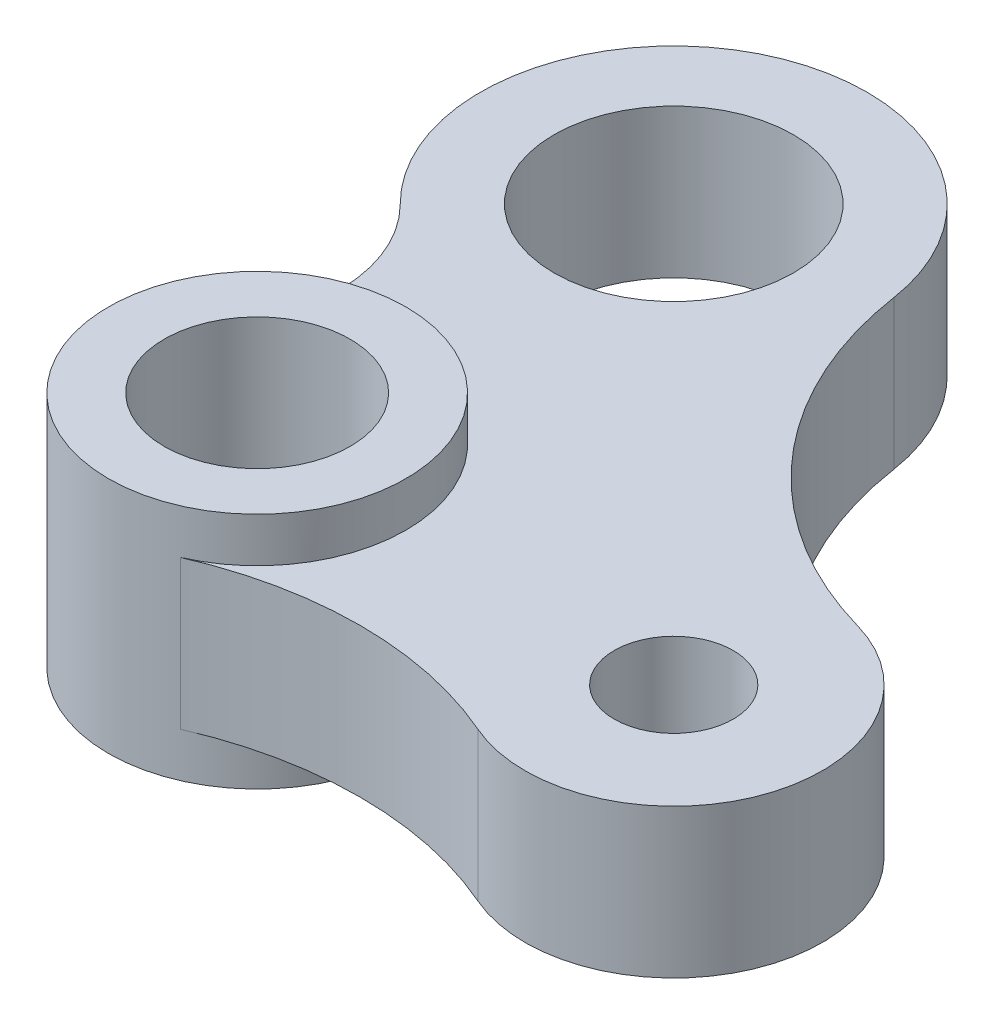
from build123d import *

# Parameters (mm, degrees)
SALIENTE_EXTRUIR1_DEPTH = 10
CROQUIS2_R              = 8.05
CROQUIS2_R_2            = 4
CORTAR_EXTRUIR1_DEPTH   = 10
CROQUIS3_R              = 10
SALIENTE_EXTRUIR2_DEPTH = 3
SALIENTE_EXTRUIR3_START = 3
CROQUIS4_R              = 10
SALIENTE_EXTRUIR3_DEPTH = 3
CROQUIS5_R              = 6.25
CORTAR_EXTRUIR2_DEPTH   = 59.14636704


with BuildPart() as part:
    # Croquis1 → Saliente-Extruir1 (new body)
    with BuildSketch(Plane(origin=(0, 0, 0), x_dir=(1, 0, 0), z_dir=(0, 1, 0))):
        with BuildLine():
            ThreePointArc((-8.111620656, 5.848214286), (-7.783099854, -6.278802168), (4, -9.16515139))
            ThreePointArc((4, -9.16515139), (14, -7.078029865), (24, -9.16515139))
            ThreePointArc((24, -9.16515139), (37.413063718, -3.375534245), (30.735830721, 9.618483782))
            ThreePointArc((30.735830721, 9.618483782), (18.80756088, 17.149005774), (12.854744679, 29.937921371))
            ThreePointArc((12.854744679, 29.937921371), (-5.873008246, 39.597748667), (-9.169658133, 18.784937888))
            ThreePointArc((-9.169658133, 18.784937888), (-6.25651887, 12.511562773), (-8.111620656, 5.848214286))
        make_face()
    extrude(amount=SALIENTE_EXTRUIR1_DEPTH)

    # Croquis2 → Cortar-Extruir1 (cut)
    with BuildSketch(Plane(origin=(0, 10, 0), x_dir=(1, 0, 0), z_dir=(0, 1, 0))):
        with Locations(Location((0, 28, 0), (0, 0, 270))):
            Circle(CROQUIS2_R)
        with Locations(Location((28, 0, 0), (0, 0, 270))):
            Circle(CROQUIS2_R_2)
    extrude(amount=-CORTAR_EXTRUIR1_DEPTH, mode=Mode.SUBTRACT)

    # Croquis3 → Saliente-Extruir2 (add)
    with BuildSketch(Plane(origin=(0, 10, 0), x_dir=(1, 0, 0), z_dir=(0, 1, 0))):
        with Locations(Location((0, 0, 0), (0, 0, 144.209624239))):
            Circle(CROQUIS3_R)
    extrude(amount=SALIENTE_EXTRUIR2_DEPTH)

    # Croquis4 → Saliente-Extruir3 (add)
    with BuildSketch(Plane.XZ.offset(SALIENTE_EXTRUIR3_START)):
        with Locations(Location((0, 0, 0), (0, 0, 270))):
            Circle(CROQUIS4_R)
    extrude(amount=-SALIENTE_EXTRUIR3_DEPTH)

    # Croquis5 → Cortar-Extruir2 (cut, through all)
    with BuildSketch(Plane(origin=(0, 13, 0), x_dir=(1, 0, 0), z_dir=(0, 1, 0))):
        with Locations(Location((0, 0, 0), (0, 0, 270))):
            Circle(CROQUIS5_R)
    extrude(amount=-CORTAR_EXTRUIR2_DEPTH, mode=Mode.SUBTRACT)


solid = part.part
